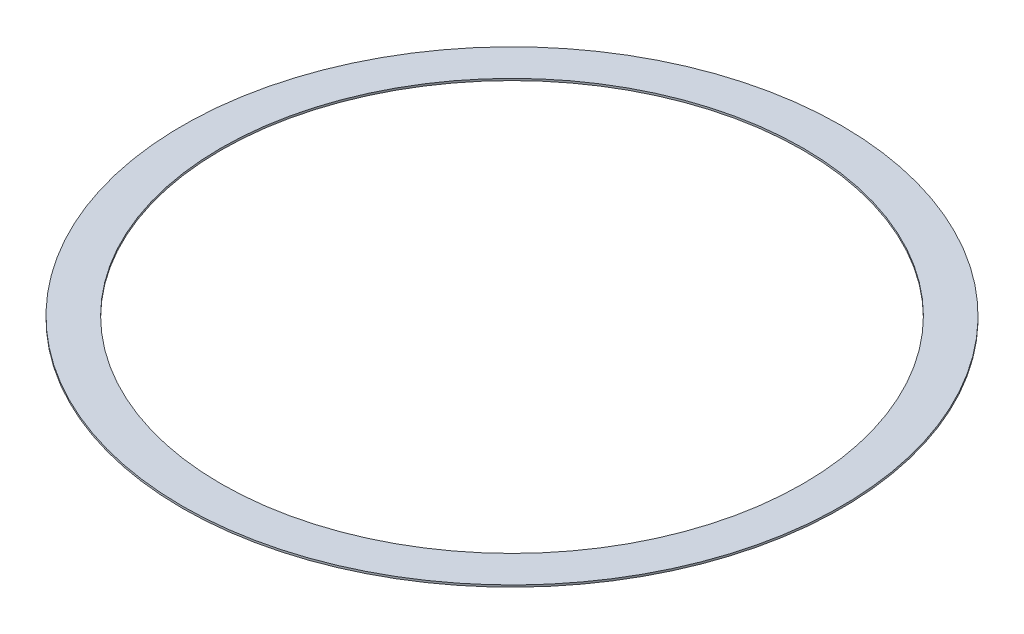
from build123d import *

# Parameters (mm, degrees)
SKETCH1_R           = 426.5
SKETCH1_R_2         = 376.5
BOSS_EXTRUDE1_DEPTH = 1.25


with BuildPart() as part:
    # Sketch1 → Boss-Extrude1 (new, symmetric)
    with BuildSketch(Plane(origin=(0, 0, 0), x_dir=(1, 0, 0), z_dir=(0, 1, 0))):
        with Locations(Location((0, 0, 0), (0, 0, 270))):
            Circle(SKETCH1_R)
        with Locations(Location((0, 0, 0), (0, 0, 270))):
            Circle(SKETCH1_R_2, mode=Mode.SUBTRACT)
    extrude(amount=BOSS_EXTRUDE1_DEPTH, both=True)


solid = part.part
